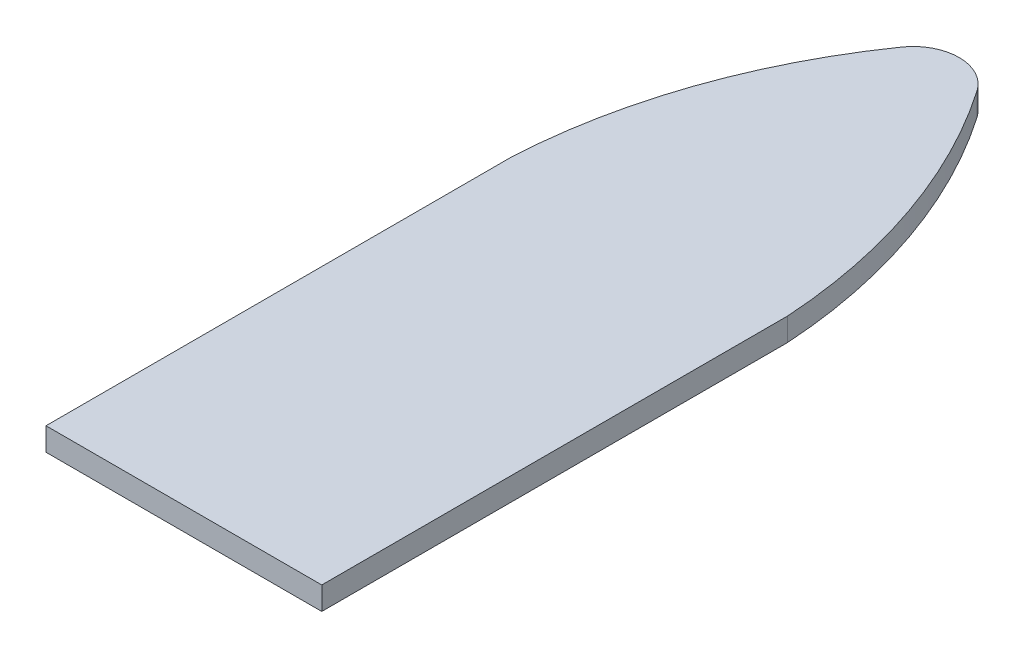
from build123d import *

# Parameters (mm, degrees)
THICKEN1_T1 = 10


with BuildPart() as body_1:
    # Sketch2 → Surface-Plane1: a flat surface bounded by the sketch
    with BuildSketch(Plane(origin=(0, 0, 0), x_dir=(1, 0, 0), z_dir=(0, 1, 0)), mode=Mode.PRIVATE) as surface_plane1_1_region:
        with BuildLine():
            Line((60, -101.35), (-60, -101.35))
            Line((-60, -101.35), (-60, 101.35))
            ThreePointArc((-60, 101.35), (-47.087611837, 167.497853897), (-16.523672609, 227.565432191))
            ThreePointArc((-16.523672609, 227.565432191), (-0.064821019, 236.113976909), (16.340966999, 227.464032864))
            ThreePointArc((16.340966999, 227.464032864), (46.741380265, 167.374149084), (60, 101.35))
            Line((60, 101.35), (60, -101.35))
        make_face()
    surface_plane1_1 = surface_plane1_1_region.sketch.faces()[0]
    add(Solid.thicken(surface_plane1_1, THICKEN1_T1))


solid = body_1.part
